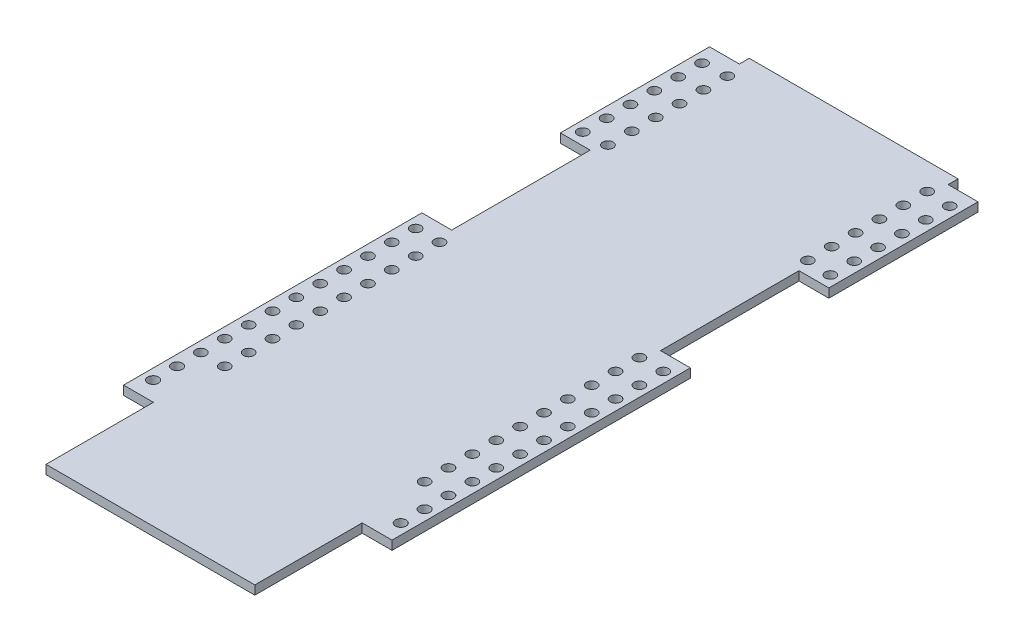
from build123d import *

# Parameters (mm, degrees)
SKETCH5_W            = 10
SKETCH5_H            = 100
BOSS_EXTRUDE5_DEPTH  = 3
M3_CLEARANCE_HOLE1_D = 3.6
SKETCH8_R            = 1.75
CUT_EXTRUDE1_DEPTH   = 249.962542564
SKETCH10_W           = 10
SKETCH10_H           = 50
SKETCH10_R           = 1.75
BOSS_EXTRUDE6_DEPTH  = 3
SKETCH11_R           = 1.75
CUT_EXTRUDE2_DEPTH   = 249.962542564


with BuildPart() as part:
    # Sketch5 → Boss-Extrude5 (new body)
    with BuildSketch(Plane(origin=(0, 0, 0), x_dir=(1, 0, 0), z_dir=(0, 1, 0))):
        with Locations((-5, 86)):
            Rectangle(SKETCH5_W, SKETCH5_H)
        Polygon((0, 0), (35, 0), (35, 235.74), (0, 235.74), (0, 136), (0, 36), align=None)
        Polygon((70, 0), (70, 36), (70, 136), (70, 235.74), (35, 235.74), (35, 0), align=None)
        with Locations((75, 86)):
            Rectangle(SKETCH5_W, SKETCH5_H)
    extrude(amount=BOSS_EXTRUDE5_DEPTH)

    # M3 Clearance Hole1 (through all)
    with Locations(Plane(origin=(0, 3, 0), x_dir=(1, 0, 0), z_dir=(0, 1, 0))):
        with Locations((76.5, 50.420635549), (76.5, 42.420635549)):
            m3_clearance_hole1 = Hole(M3_CLEARANCE_HOLE1_D / 2)

    # Sketch8 → Cut-Extrude1 (cut, through all)
    with BuildSketch(Plane(origin=(0, 3, 0), x_dir=(1, 0, 0), z_dir=(0, 1, 0))):
        with Locations(Location((76.5, 58.420635549, 0), (0, 0, 270))):
            Circle(SKETCH8_R)
        with Locations(Location((76.5, 66.420635549, 0), (0, 0, 270))):
            Circle(SKETCH8_R)
        with Locations(Location((76.5, 74.420635549, 0), (0, 0, 270))):
            Circle(SKETCH8_R)
        with Locations(Location((76.5, 82.420635549, 0), (0, 0, 270))):
            Circle(SKETCH8_R)
        with Locations(Location((68.5, 58.420635549, 0), (0, 0, 270))):
            Circle(SKETCH8_R)
        with Locations(Location((68.5, 66.420635549, 0), (0, 0, 270))):
            Circle(SKETCH8_R)
        with Locations(Location((68.5, 74.420635549, 0), (0, 0, 270))):
            Circle(SKETCH8_R)
        with Locations(Location((68.5, 82.420635549, 0), (0, 0, 270))):
            Circle(SKETCH8_R)
        with Locations(Location((68.5, 90.420635549, 0), (0, 0, 270))):
            Circle(SKETCH8_R)
        with Locations(Location((76.5, 90.420635549, 0), (0, 0, 270))):
            Circle(SKETCH8_R)
        with Locations(Location((76.5, 98.420635549, 0), (0, 0, 270))):
            Circle(SKETCH8_R)
        with Locations(Location((68.5, 98.420635549, 0), (0, 0, 270))):
            Circle(SKETCH8_R)
        with Locations(Location((68.5, 106.420635549, 0), (0, 0, 270))):
            Circle(SKETCH8_R)
        with Locations(Location((76.5, 106.420635549, 0), (0, 0, 270))):
            Circle(SKETCH8_R)
        with Locations(Location((68.5, 114.420635549, 0), (0, 0, 270))):
            Circle(SKETCH8_R)
        with Locations(Location((76.5, 114.420635549, 0), (0, 0, 270))):
            Circle(SKETCH8_R)
        with Locations(Location((68.5, 122.420635549, 0), (0, 0, 270))):
            Circle(SKETCH8_R)
        with Locations(Location((76.5, 122.420635549, 0), (0, 0, 270))):
            Circle(SKETCH8_R)
        with Locations(Location((76.5, 130.420635549, 0), (0, 0, 270))):
            Circle(SKETCH8_R)
        with Locations(Location((68.5, 130.420635549, 0), (0, 0, 270))):
            Circle(SKETCH8_R)
    cut_extrude1 = extrude(amount=-CUT_EXTRUDE1_DEPTH, mode=Mode.SUBTRACT)

    # Sketch10 → Boss-Extrude6 (add)
    with BuildSketch(Plane.XZ):
        with Locations((75, -207.420635549)):
            Rectangle(SKETCH10_W, SKETCH10_H)
        with Locations(Location((76.5, -186.420635549, 0), (0, 0, 270))):
            Circle(SKETCH10_R, mode=Mode.SUBTRACT)
        with Locations(Location((76.5, -194.420635549, 0), (0, 0, 270))):
            Circle(SKETCH10_R, mode=Mode.SUBTRACT)
        with Locations(Location((76.5, -202.420635549, 0), (0, 0, 270))):
            Circle(SKETCH10_R, mode=Mode.SUBTRACT)
        with Locations(Location((76.5, -210.420635549, 0), (0, 0, 270))):
            Circle(SKETCH10_R, mode=Mode.SUBTRACT)
        with Locations(Location((76.5, -218.420635549, 0), (0, 0, 270))):
            Circle(SKETCH10_R, mode=Mode.SUBTRACT)
        with Locations(Location((76.5, -226.420635549, 0), (0, 0, 270))):
            Circle(SKETCH10_R, mode=Mode.SUBTRACT)
    boss_extrude6 = extrude(amount=-BOSS_EXTRUDE6_DEPTH)

    # Sketch11 → Cut-Extrude2 (cut, through all)
    with BuildSketch(Plane(origin=(0, 3, 0), x_dir=(1, 0, 0), z_dir=(0, 1, 0))):
        with Locations(Location((68.5, 226.886570254, 0), (0, 0, 270))):
            Circle(SKETCH11_R)
        with Locations(Location((68.5, 218.886570254, 0), (0, 0, 270))):
            Circle(SKETCH11_R)
        with Locations(Location((68.5, 210.886570254, 0), (0, 0, 270))):
            Circle(SKETCH11_R)
        with Locations(Location((68.5, 202.886570254, 0), (0, 0, 270))):
            Circle(SKETCH11_R)
        with Locations(Location((68.5, 194.886570254, 0), (0, 0, 270))):
            Circle(SKETCH11_R)
        with Locations(Location((68.5, 186.886570254, 0), (0, 0, 270))):
            Circle(SKETCH11_R)
    cut_extrude2 = extrude(amount=-CUT_EXTRUDE2_DEPTH, mode=Mode.SUBTRACT)

    # Mirror1: M3 Clearance Hole1, Cut-Extrude1, Boss-Extrude6, Cut-Extrude2 across plane
    add(m3_clearance_hole1.mirror(Plane.ZY.offset(-35)), mode=Mode.SUBTRACT)
    add(cut_extrude1.mirror(Plane.ZY.offset(-35)), mode=Mode.SUBTRACT)
    add(boss_extrude6.mirror(Plane.ZY.offset(-35)))
    add(cut_extrude2.mirror(Plane.ZY.offset(-35)), mode=Mode.SUBTRACT)


solid = part.part
